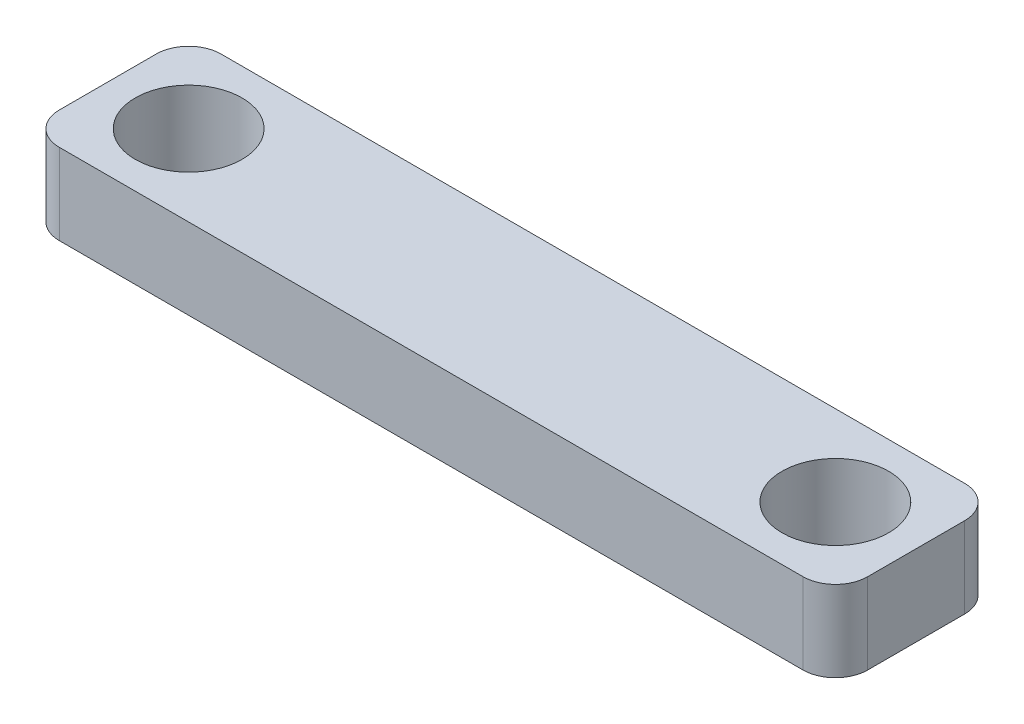
from build123d import *

# Parameters (mm, degrees)
SKETCH_1_W      = 250
SKETCH_1_H      = 50
SKETCH_1_R      = 16.5
EXTRUDE_1_DEPTH = 25
FILLET_1_R      = 10


with BuildPart() as part:
    # 草图1 → 凸台-拉伸1 (new body)
    with BuildSketch(Plane(origin=(0, 0, 0), x_dir=(1, 0, 0), z_dir=(0, 1, 0))):
        with Locations((125, 25)):
            Rectangle(SKETCH_1_W, SKETCH_1_H)
        with Locations(Location((25, 25, 0), (0, 0, 270))):
            Circle(SKETCH_1_R, mode=Mode.SUBTRACT)
        with Locations(Location((225, 25, 0), (0, 0, 270))):
            Circle(SKETCH_1_R, mode=Mode.SUBTRACT)
    extrude(amount=EXTRUDE_1_DEPTH)

    # 圆角1
    fillet_1_edges = [part.edges().sort_by_distance(p)[0] for p in [
        (0, 12.5, -50),
        (250, 12.5, -50),
        (250, 12.5, 0),
        (0, 12.5, 0),
    ]]
    fillet(fillet_1_edges, radius=FILLET_1_R)


solid = part.part
